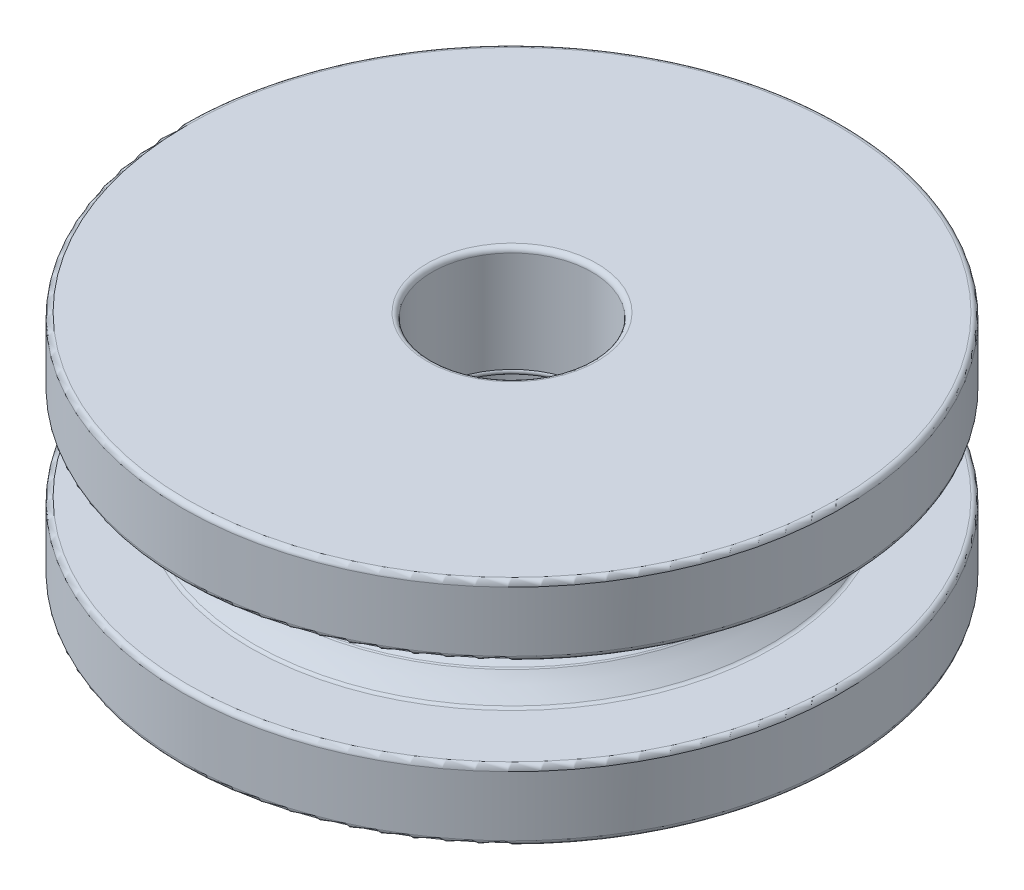
from build123d import *

# Parameters (mm, degrees)
SKETCH2_R          = 4.2
CUT_EXTRUDE1_DEPTH = 50.668903753
CUT_EXTRUDE1_DRAFT = -1.5
FILLET1_R          = 0.5


with BuildPart() as part:
    # Sketch1 → Revolve1 (revolve)
    with BuildSketch(Plane(origin=(0, 0, 0), x_dir=(0, 0, -1), z_dir=(1, 0, 0))):
        with BuildLine():
            Line((-33, 0), (0, 0))
            Line((0, 0), (0, 6))
            Line((0, 6), (-8, 6))
            Line((-8, 6), (-8, 12))
            ThreePointArc((-8, 12), (-7.93032073, 12.199986164), (-8, 12.399972329))
            Line((-8, 12.399972329), (-8, 15.5))
            Line((-8, 15.5), (-8, 23))
            Line((-8, 23), (-33, 23))
            Line((-33, 23), (-33, 16))
            Line((-33, 16), (-26, 16))
            add(Edge.make_bspline(
                [(-24.080585445, 13.797751197), (-24.612643103, 14.620109751), (-26, 16)],
                knots=[0, 0, 0, 1, 1, 1], degree=2, weights=[1, 1.045697504, 1]))
            add(Edge.make_bspline(
                [(-24.080585445, 13.797751197), (-20.86965508, 11.474175575), (-24.080585445, 9.150599954)],
                knots=[0, 0, 0, 1, 1, 1], degree=2, weights=[1, 1.840664215, 1]))
            add(Edge.make_bspline(
                [(-26, 7), (-24.612643103, 8.379890249), (-24.080585445, 9.150599954)],
                knots=[0, 0, 0, 1, 1, 1], degree=2, weights=[1, 1.045697504, 1]))
            Line((-26, 7), (-33, 7))
            Line((-33, 7), (-33, 0))
        make_face()
    revolve(axis=Axis((0, 39.130434783, 0), (0, -1, 0)))


with BuildPart() as cut_extrude1_tool:
    # Sketch2 → Cut-Extrude1 (with draft: the straight prism first)
    with BuildSketch(Plane.XZ.offset(-6)):
        Circle(SKETCH2_R)
    extrude(amount=CUT_EXTRUDE1_DEPTH)
    # Cut-Extrude1: the draft: its side faces are tilted about the plane it starts from
    cut_extrude1_sides = [cut_extrude1_tool.faces().sort_by_distance(p)[0] for p in [
        (-4.2, -19.334451876, 0),
    ]]
    draft(cut_extrude1_sides, Plane.XZ.offset(-6), CUT_EXTRUDE1_DRAFT)


with BuildPart() as part_1:
    add(part.part)

    # Cut-Extrude1: cut by cut_extrude1_tool
    add(cut_extrude1_tool.part, mode=Mode.SUBTRACT)

    # Fillet1
    fillet1_edges = [part_1.edges().sort_by_distance(p)[0] for p in [
        (-4.357115529, 0, 0),
        (0, 23, -8),
        (0, 23, -33),
        (0, 7, -33),
        (0, 16, -33),
        (0, 7, -26),
        (0, 0, -33),
        (0, 9.150599954, -24.080585445),
        (0, 13.797751197, -24.080585445),
        (0, 16, -26),
    ]]
    fillet(fillet1_edges, radius=FILLET1_R)


solid = part_1.part
